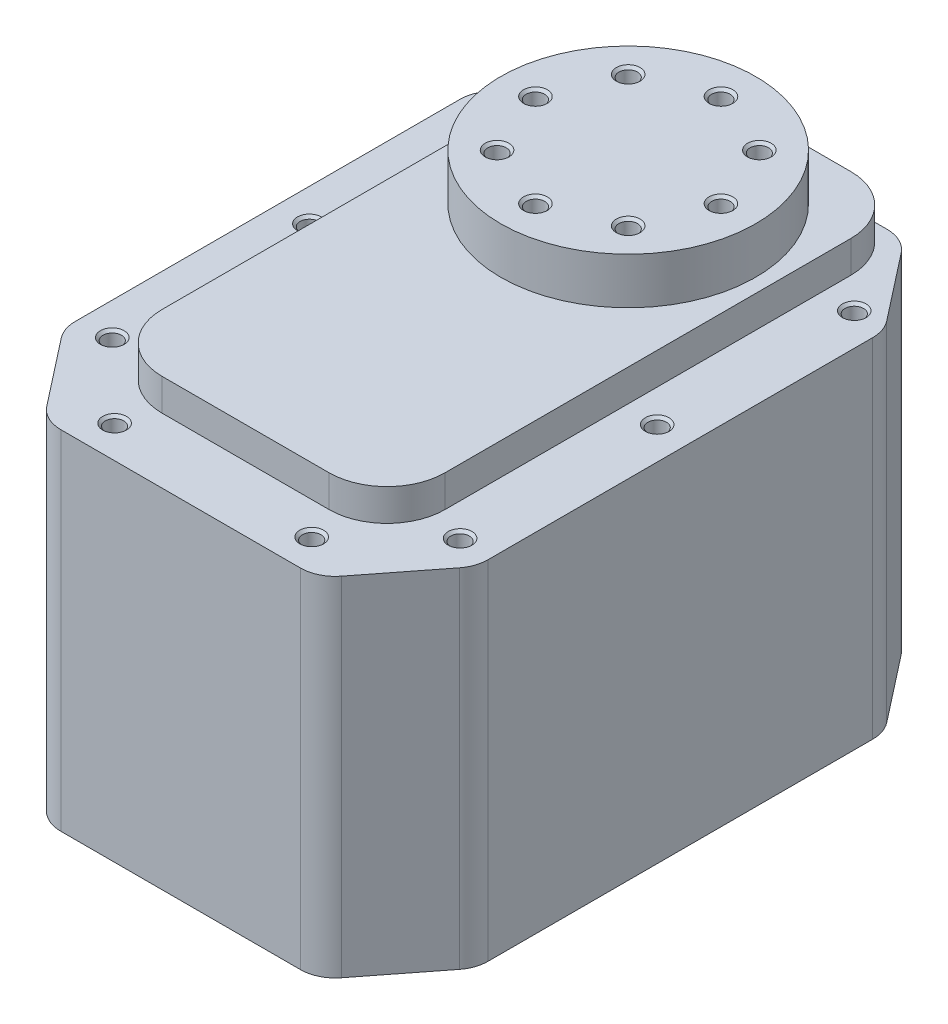
from build123d import *
from OCP.BRepFilletAPI import BRepFilletAPI_MakeChamfer

# Parameters (mm, degrees)
SKETCH1_W                       = 24.4
SKETCH1_H                       = 45
BOSS_EXTRUDE1_DEPTH             = 35.5
FILLET1_R                       = 5
SKETCH2_W                       = 35.6
SKETCH2_H                       = 50.6
BOSS_EXTRUDE2_DEPTH             = 15
CHAMFER2_SIZE                   = 6
CHAMFER2_SIZE2                  = 7.679649793
FILLET2_R                       = 3
SKETCH3_R                       = 11
BOSS_EXTRUDE3_DEPTH             = 4
BOSS_EXTRUDE5_START             = -38
SKETCH3_3_R                     = 11
BOSS_EXTRUDE5_DEPTH             = 2.5
M2X0_4_TAPPED_HOLE1_D           = 1.6
M2X0_4_TAPPED_HOLE1_CSINK_D     = 2.05
M2X0_4_TAPPED_HOLE1_CSINK_ANGLE = 90
M2X0_4_TAPPED_HOLE2_D           = 1.6
M2X0_4_TAPPED_HOLE2_CSINK_D     = 2.05
M2X0_4_TAPPED_HOLE2_CSINK_ANGLE = 90


with BuildPart() as part:
    # Sketch1 → Boss-Extrude1 (new body)
    with BuildSketch(Plane(origin=(0, 0, 0), x_dir=(1, 0, 0), z_dir=(0, 1, 0))):
        with Locations((0, -10.5)):
            Rectangle(SKETCH1_W, SKETCH1_H)
    extrude(amount=-BOSS_EXTRUDE1_DEPTH)

    # Fillet1
    fillet1_edges = [part.edges().sort_by_distance(p)[0] for p in [
        (-12.2, -17.75, -12),
        (12.2, -17.75, -12),
        (12.2, -17.75, 33),
        (-12.2, -17.75, 33),
    ]]
    fillet(fillet1_edges, radius=FILLET1_R)

    # Sketch2 → Boss-Extrude2 (add, symmetric)
    with BuildSketch(Plane(origin=(0, -17.75, 0), x_dir=(1, 0, 0), z_dir=(0, 1, 0))):
        with Locations((0, -13.3)):
            Rectangle(SKETCH2_W, SKETCH2_H)
    extrude(amount=BOSS_EXTRUDE2_DEPTH, both=True)

    # Chamfer2: one chamfer whose edges measure the first distance from different faces: ONE call of the kernel's chamfer builder (chamfer() names one face for all edges)
    chamfer2_edges_1 = [part.edges().sort_by_distance(p)[0] for p in [
        (-17.8, -17.75, -12),
        (17.8, -17.75, -12),
    ]]
    chamfer2_side_1 = [part.faces().sort_by_distance(p)[0] for p in [
        (0, -17.75, -12),
    ]]
    chamfer2_edges_2 = [part.edges().sort_by_distance(p)[0] for p in [
        (-17.8, -17.75, 38.6),
        (17.8, -17.75, 38.6),
    ]]
    chamfer2_side_2 = [part.faces().sort_by_distance(p)[0] for p in [
        (0, -17.75, 38.6),
    ]]
    chamfer2 = BRepFilletAPI_MakeChamfer(part.part.solid().wrapped)
    for e in chamfer2_edges_1:
        chamfer2.Add(CHAMFER2_SIZE, CHAMFER2_SIZE2, e.wrapped, chamfer2_side_1[0].wrapped)  # the first distance lies on this face
    for e in chamfer2_edges_2:
        chamfer2.Add(CHAMFER2_SIZE, CHAMFER2_SIZE2, e.wrapped, chamfer2_side_2[0].wrapped)  # the first distance lies on this face
    add(Compound.cast(chamfer2.Shape()), mode=Mode.REPLACE)

    # Fillet2
    fillet2_edges = [part.edges().sort_by_distance(p)[0] for p in [
        (17.8, -17.75, -4.320350207),
        (17.8, -17.75, 30.920350207),
        (-11.8, -17.75, 38.6),
        (11.8, -17.75, 38.6),
        (-17.8, -17.75, -4.320350207),
        (-17.8, -17.75, 30.920350207),
        (-11.8, -17.75, -12),
        (11.8, -17.75, -12),
    ]]
    fillet(fillet2_edges, radius=FILLET2_R)

    # Sketch3 → Boss-Extrude3 (add)
    with BuildSketch(Plane(origin=(0, 0, 0), x_dir=(1, 0, 0), z_dir=(0, 1, 0))):
        with Locations(Location((0, 0, 0), (0, 0, 270))):
            Circle(SKETCH3_R)
    extrude(amount=BOSS_EXTRUDE3_DEPTH)

    # Sketch3<3> → Boss-Extrude5 (add)
    with BuildSketch(Plane(origin=(0, 0, 0), x_dir=(1, 0, 0), z_dir=(0, 1, 0)).offset(BOSS_EXTRUDE5_START)):
        with Locations(Location((0, 0, 0), (0, 0, 270))):
            Circle(SKETCH3_3_R)
    extrude(amount=BOSS_EXTRUDE5_DEPTH)

    # M2x0.4 Tapped Hole1 (through all)
    with Locations(Plane(origin=(0, 4, 0), x_dir=(1, 0, 0), z_dir=(0, 1, 0))):
        with Locations((-5.656854249, 5.656854249), (0, 8), (5.656854249, 5.656854249), (8, 0), (5.656854249, -5.656854249), (0, -8), (-5.656854249, -5.656854249), (-8, 0)):
            CounterSinkHole(M2X0_4_TAPPED_HOLE1_D / 2, M2X0_4_TAPPED_HOLE1_CSINK_D / 2, counter_sink_angle=M2X0_4_TAPPED_HOLE1_CSINK_ANGLE)

    # M2x0.4 Tapped Hole2 (through all)
    with Locations(Plane(origin=(0, -2.75, 0), x_dir=(1, 0, 0), z_dir=(0, 1, 0))):
        with Locations((15, 4.5), (-15, 4.5), (-15, -12.5), (-15, -29.5), (-8.5, -35.8), (8.5, -35.8), (15, -29.5), (15, -12.5)):
            CounterSinkHole(M2X0_4_TAPPED_HOLE2_D / 2, M2X0_4_TAPPED_HOLE2_CSINK_D / 2, counter_sink_angle=M2X0_4_TAPPED_HOLE2_CSINK_ANGLE)


solid = part.part
